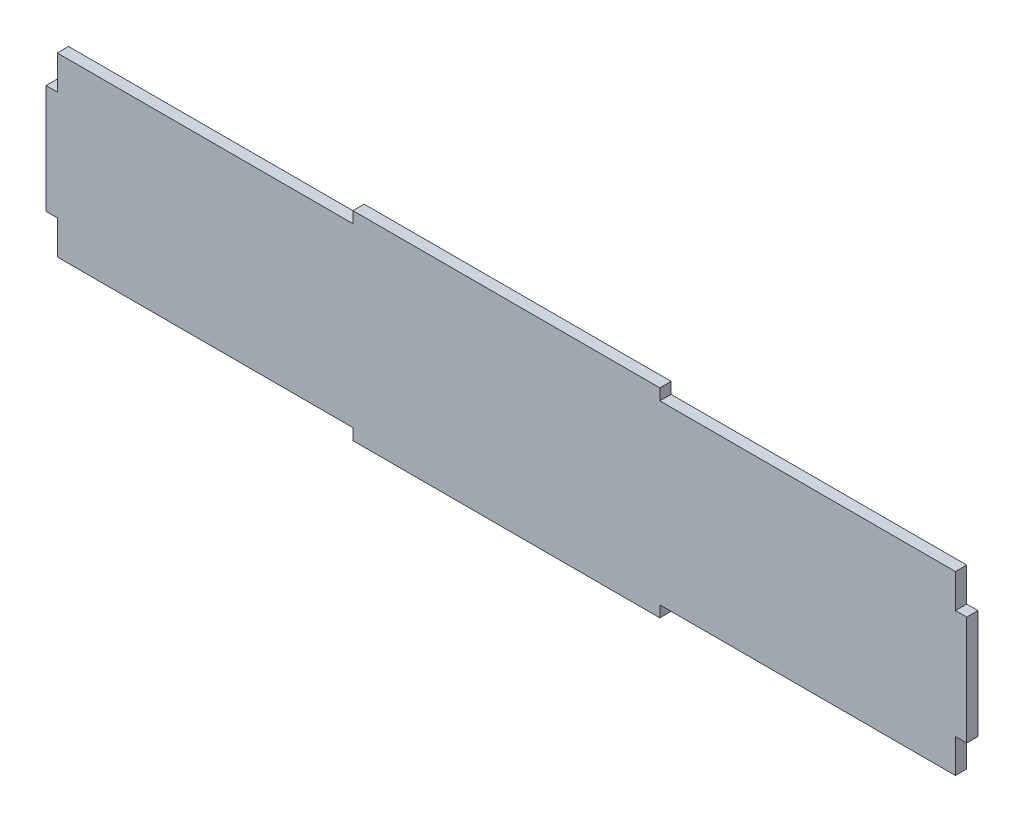
from build123d import *

# Parameters (mm, degrees)
SKETCH1_W           = 490
SKETCH1_H           = 106.02
BOSS_EXTRUDE1_DEPTH = 6
SKETCH2_W           = 6
SKETCH2_H           = 24
CUT_EXTRUDE1_DEPTH  = 502.374351558
SKETCH3_W           = 157.333333333
SKETCH3_H           = 6
CUT_EXTRUDE2_DEPTH  = 502.374351558


with BuildPart() as part:
    # Sketch1 → Boss-Extrude1 (new body)
    with BuildSketch(Plane.XY):
        with Locations((245, 53.01)):
            Rectangle(SKETCH1_W, SKETCH1_H)
    extrude(amount=BOSS_EXTRUDE1_DEPTH)

    # Sketch2 → Cut-Extrude1 (cut, through all)
    with BuildSketch(Plane.XY.offset(6)):
        with Locations((487, 12)):
            Rectangle(SKETCH2_W, SKETCH2_H)
        with Locations((487, 94.02)):
            Rectangle(SKETCH2_W, SKETCH2_H)
        with Locations((3, 94.02)):
            Rectangle(SKETCH2_W, SKETCH2_H)
        with Locations((3, 12)):
            Rectangle(SKETCH2_W, SKETCH2_H)
    extrude(amount=-CUT_EXTRUDE1_DEPTH, mode=Mode.SUBTRACT)

    # Sketch3 → Cut-Extrude2 (cut, through all)
    with BuildSketch(Plane.XY.offset(6)):
        with Locations((84.666666667, 3)):
            Rectangle(SKETCH3_W, SKETCH3_H)
        with Locations((405.333333334, 3)):
            Rectangle(SKETCH3_W, SKETCH3_H)
        with Locations((84.666666667, 103.02)):
            Rectangle(SKETCH3_W, SKETCH3_H)
        with Locations((405.333333334, 103.02)):
            Rectangle(SKETCH3_W, SKETCH3_H)
    extrude(amount=-CUT_EXTRUDE2_DEPTH, mode=Mode.SUBTRACT)


solid = part.part
